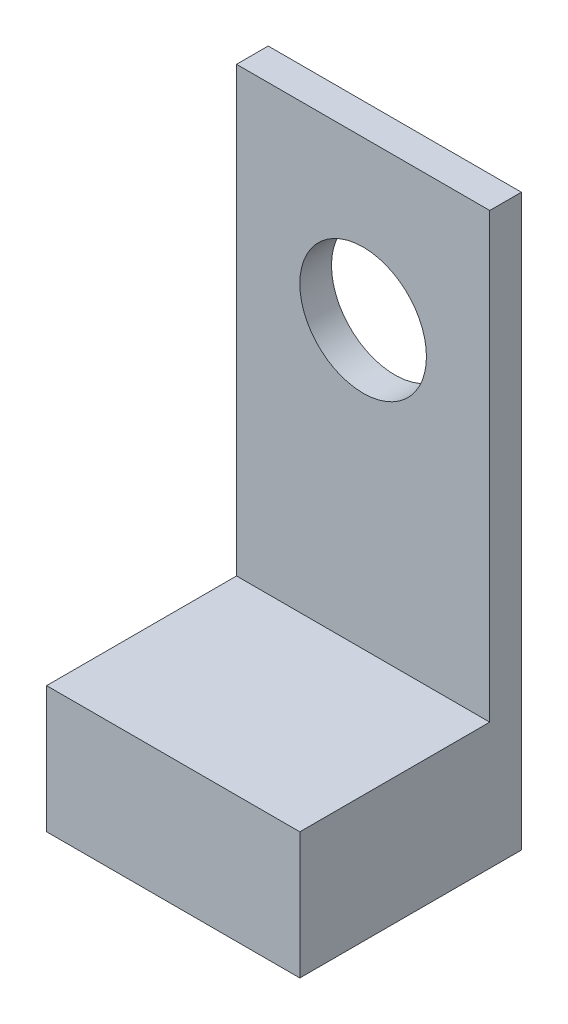
from build123d import *

# Parameters (mm, degrees)
SKETCH1_W           = 40
SKETCH1_H           = 90
BOSS_EXTRUDE1_DEPTH = 5
SKETCH2_W           = 40
SKETCH2_H           = 20
BOSS_EXTRUDE2_DEPTH = 30
SKETCH3_R           = 10
CUT_EXTRUDE1_DEPTH  = 30


with BuildPart() as part:
    # Sketch1 → Boss-Extrude1 (new body)
    with BuildSketch(Plane.XY):
        with Locations((-0.107274634, 14.603113743)):
            Rectangle(SKETCH1_W, SKETCH1_H)
    extrude(amount=BOSS_EXTRUDE1_DEPTH)

    # Sketch2 → Boss-Extrude2 (add)
    with BuildSketch(Plane.XY.offset(5)):
        with Locations((-0.107274634, -20.396886257)):
            Rectangle(SKETCH2_W, SKETCH2_H)
    extrude(amount=BOSS_EXTRUDE2_DEPTH)

    # Sketch3 → Cut-Extrude1 (cut)
    with BuildSketch(Plane(origin=(0, 0, 0), x_dir=(-1, 0, 0), z_dir=(0, 0, -1))):
        with Locations((0.107274634, 34.603113743)):
            Circle(SKETCH3_R)
    extrude(amount=-CUT_EXTRUDE1_DEPTH, mode=Mode.SUBTRACT)


solid = part.part
